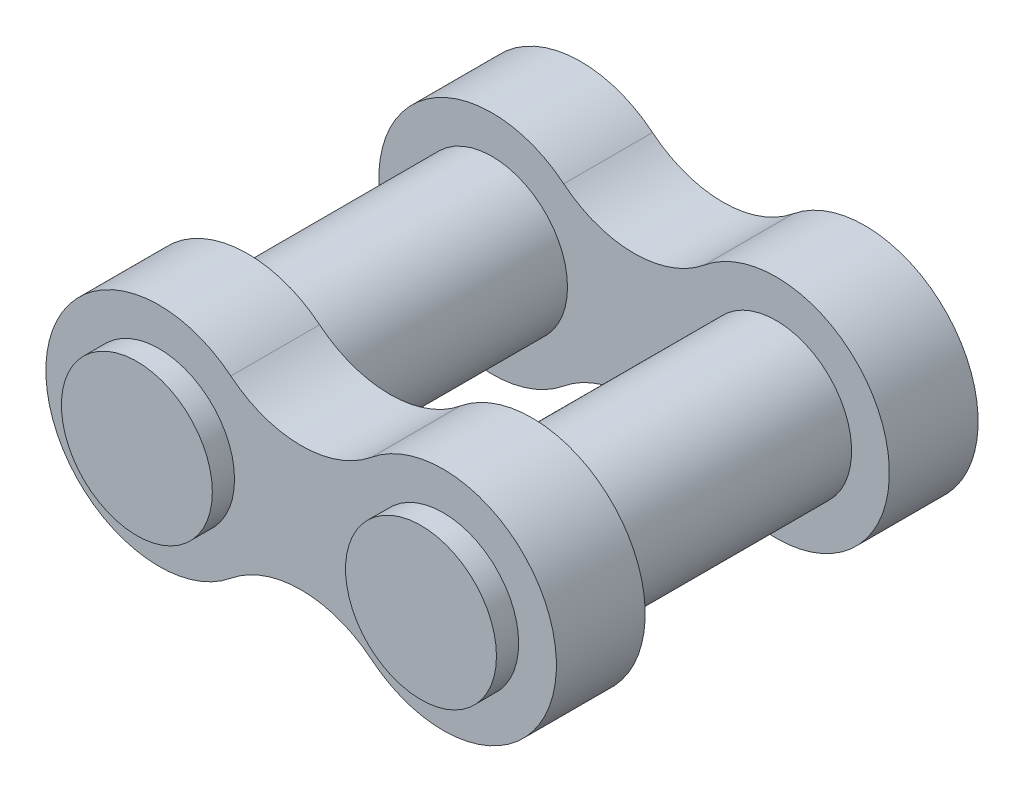
from build123d import *

# Parameters (mm, degrees)
CROQUIS1_R                   = 1.7
SALIENTE_EXTRUIR1_DEPTH      = 2
SALIENTE_EXTRUIR2_DEPTH      = 8
SALIENTE_EXTRUIR2_DEPTH_BACK = 2.5
CROQUIS3_R                   = 1.7


with BuildPart() as part:
    # Croquis1 → Saliente-Extruir1 (new body)
    with BuildSketch(Plane.XY):
        with BuildLine():
            ThreePointArc((-1.584158416, 1.972702708), (-5.75, 0), (-1.584158416, -1.972702708))
            ThreePointArc((-1.584158416, -1.972702708), (0, -1.406724971), (1.584158416, -1.972702708))
            ThreePointArc((1.584158416, -1.972702708), (5.75, 0), (1.584158416, 1.972702708))
            ThreePointArc((1.584158416, 1.972702708), (0, 1.406724971), (-1.584158416, 1.972702708))
        make_face()
        with Locations((-3.2, 0)):
            Circle(CROQUIS1_R, mode=Mode.SUBTRACT)
        with Locations(Location((3.2, 0, 0), (0, 0, 180))):
            Circle(CROQUIS1_R, mode=Mode.SUBTRACT)
    saliente_extruir1 = extrude(amount=SALIENTE_EXTRUIR1_DEPTH)

    # Croquis3 → Saliente-Extruir2 (add, two sides: drawn at the far end of the back side and taken through both)
    with BuildSketch(Plane.XY.offset(2).offset(-SALIENTE_EXTRUIR2_DEPTH_BACK)):
        with Locations((-3.2, 0)):
            Circle(CROQUIS3_R)
        with Locations((3.2, 0)):
            Circle(CROQUIS3_R)
    extrude(amount=SALIENTE_EXTRUIR2_DEPTH + SALIENTE_EXTRUIR2_DEPTH_BACK)

    # Simetría1: Saliente-Extruir1 across plane
    add(saliente_extruir1.mirror(Plane.XY.offset(4.75)))


solid = part.part
